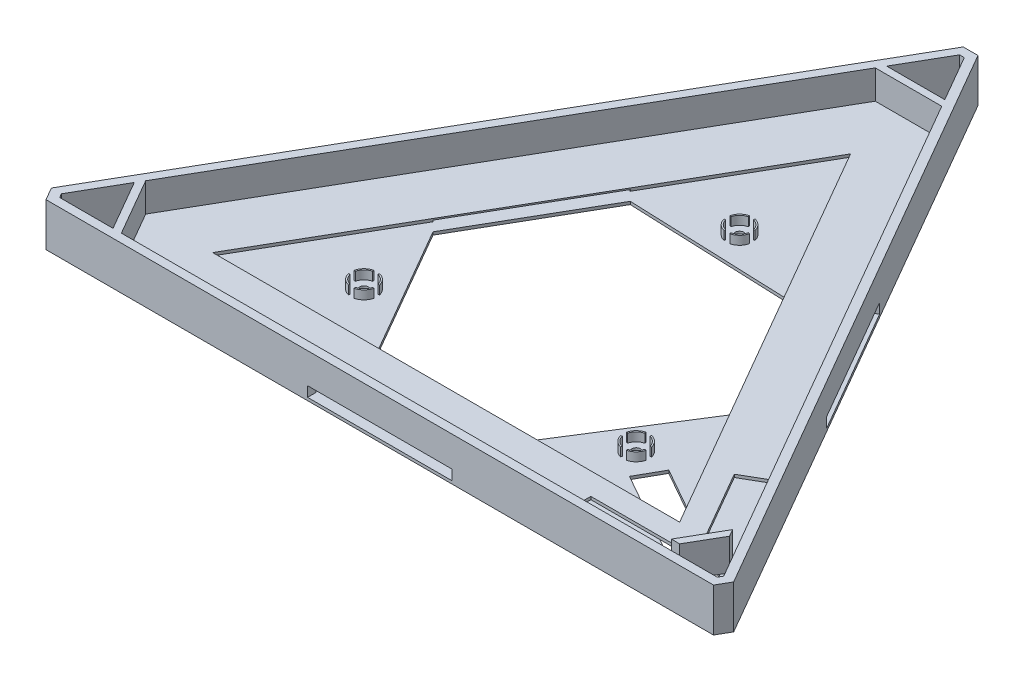
from build123d import *

# Parameters (mm, degrees)
SKETCH1_W                = 34.714871787
SKETCH1_H                = 10.923666426
BOSS_EXTRUDE1_DEPTH      = 1
BOSS_EXTRUDE2_DEPTH      = 11
BOSS_EXTRUDE3_DEPTH      = 5
BOSS_EXTRUDE3_DEPTH_BACK = 3
SKETCH3_W                = 50
SKETCH3_H                = 7
CUT_EXTRUDE3_DEPTH       = 25
SKETCH5_W                = 50
SKETCH5_H                = 7
CUT_EXTRUDE4_DEPTH       = 25
SKETCH6_W                = 50
SKETCH6_H                = 7
CUT_EXTRUDE5_DEPTH       = 25
SKETCH8_R                = 1.5
BOSS_EXTRUDE5_DEPTH      = 1
BOSS_EXTRUDE10_DEPTH     = 3


with BuildPart() as part:
    # Sketch1 → Boss-Extrude1 (new body)
    with BuildSketch(Plane(origin=(0, 0, 0), x_dir=(1, 0, 0), z_dir=(0, 1, 0))):
        Polygon((243.304219775, -116.484791865), (254.809280577, -136.408896137), (442.602090749, -136.409305398), (444.621046679, -132.925433224), (441.749040748, -132.925433224), (449.516726724, -119.471406458), (450.964695298, -121.978953123), (452.699916622, -118.984688018), (358.778179036, 43.666038065), (335.767496284, 43.666038065), align=None)
        with Locations((422.370878913, -129.522754792)):
            Rectangle(SKETCH1_W, SKETCH1_H, mode=Mode.SUBTRACT)
        Polygon((423.190377512, -92.577472767), (432.651287025, -87.114324326), (450.119365975, -117.364996826), (440.658456462, -122.828145267), align=None, mode=Mode.SUBTRACT)
        Polygon((428.113670919, -116.417164681), (266.439108268, -116.428009237), (347.273609729, 23.609230821), align=None, mode=Mode.SUBTRACT)
    extrude(amount=BOSS_EXTRUDE1_DEPTH)

    # Sketch1<9> → Boss-Extrude2 (add)
    # profile 1 of 2: a face of its own
    with BuildSketch(Plane(origin=(0, 0, 0), x_dir=(1, 0, 0), z_dir=(0, 1, 0))):
        Polygon((229.159432548, -134.984249184), (231.716666588, -139.412373829), (462.829865412, -139.412373829), (465.38624875, -134.984588004), (349.829542096, 65.165499075), (344.716133219, 65.165499075), align=None)
        Polygon((251.922647989, -136.409305399), (233.446303401, -136.408896138), (232.62355396, -134.984217357), (241.860901689, -118.984688018), align=None, mode=Mode.SUBTRACT)
        Polygon((442.602090749, -136.409305398), (254.809280577, -136.408896137), (243.304219775, -116.484791865), (335.767496284, 43.666038065), (358.778179036, 43.666038065), (461.938967958, -134.984588006), (461.116393749, -136.409305398), align=None, mode=Mode.SUBTRACT)
        Polygon((348.096628302, 62.164013367), (357.334800991, 46.166038067), (337.210874326, 46.166038067), (346.44844193, 62.165948237), align=None, mode=Mode.SUBTRACT)
    # profile 2 of 2: a face of its own
    with BuildSketch(Plane(origin=(0, 0, 0), x_dir=(1, 0, 0), z_dir=(0, 1, 0))):
        Polygon((441.749040748, -132.925433224), (444.621046679, -132.925433224), (450.964695298, -121.978953123), (449.516726724, -119.471406458), align=None)
    extrude(amount=BOSS_EXTRUDE2_DEPTH)

    # Sketch1<10> → Boss-Extrude3 (add, two sides: drawn at the far end of the back side and taken through both)
    with BuildSketch(Plane(origin=(0, 0, 0), x_dir=(1, 0, 0), z_dir=(0, 1, 0)).offset(-BOSS_EXTRUDE3_DEPTH_BACK)):
        Polygon((229.159432548, -134.984249184), (231.716666588, -139.412373829), (462.829865412, -139.412373829), (465.38624875, -134.984588004), (349.829542096, 65.165499075), (344.716133219, 65.165499075), align=None)
        Polygon((251.922647989, -136.409305399), (233.446303401, -136.408896138), (232.62355396, -134.984217357), (241.860901689, -118.984688018), align=None, mode=Mode.SUBTRACT)
        Polygon((442.602090749, -136.409305398), (254.809280577, -136.408896137), (243.304219775, -116.484791865), (335.767496284, 43.666038065), (358.778179036, 43.666038065), (452.699916622, -118.984688018), (461.938967958, -134.984588006), (461.116393749, -136.409305398), align=None, mode=Mode.SUBTRACT)
        Polygon((348.096628302, 62.164013367), (357.334800991, 46.166038067), (337.210874326, 46.166038067), (346.44844193, 62.165948237), align=None, mode=Mode.SUBTRACT)
    extrude(amount=BOSS_EXTRUDE3_DEPTH + BOSS_EXTRUDE3_DEPTH_BACK)

    # Sketch3 → Cut-Extrude3 (cut)
    with BuildSketch(Plane(origin=(290.589645397, 0, -167.772009994), x_dir=(-0.49999999999998745, 0, -0.8660254037844459), z_dir=(0.8660254037844459, 0, -0.49999999999998745))):
        with Locations((-236.592990632, -3)):
            Rectangle(SKETCH3_W, SKETCH3_H)
    extrude(amount=-CUT_EXTRUDE3_DEPTH, mode=Mode.SUBTRACT)

    # Sketch5 → Cut-Extrude4 (cut)
    with BuildSketch(Plane.XY.offset(139.412373829)):
        with Locations((347.273266, -3)):
            Rectangle(SKETCH5_W, SKETCH5_H)
    extrude(amount=-CUT_EXTRUDE4_DEPTH, mode=Mode.SUBTRACT)

    # Sketch6 → Cut-Extrude5 (cut)
    with BuildSketch(Plane(origin=(230.319375798, 0, 132.975171837), x_dir=(-0.5000006154012504, 0, 0.8660250484820695), z_dir=(-0.8660250484820695, 0, -0.5000006154012504))):
        with Locations((-113.236674799, -3)):
            Rectangle(SKETCH6_W, SKETCH6_H)
    extrude(amount=-CUT_EXTRUDE5_DEPTH, mode=Mode.SUBTRACT)

    # Sketch8 → Boss-Extrude5 (add)
    with BuildSketch(Plane.XZ.offset(3)):
        Polygon((349.829542096, -65.165499075), (465.38624875, 134.984588004), (462.829865412, 139.412373829), (231.716666588, 139.412373829), (229.159432548, 134.984249184), (344.716133219, -65.165499075), align=None)
        with Locations((395.323540807, 98.692824234)):
            Circle(SKETCH8_R, mode=Mode.SUBTRACT)
        with Locations((348.301285091, 15.863526629)):
            Circle(SKETCH8_R, mode=Mode.SUBTRACT)
        with Locations((299.654911442, 97.24168178)):
            Circle(SKETCH8_R, mode=Mode.SUBTRACT)
        Polygon((450.14703547, 123.280701064), (452.699916622, 118.984688018), (461.938967958, 134.984588006), (461.116393749, 136.409305398), (442.602090749, 136.409305398), (445.226665069, 131.986443715), (401.697951811, 107.384591709), (406.618322213, 98.678849058), align=None, mode=Mode.SUBTRACT)
        Polygon((322.273266, 116.42426408), (294.358218631, 68.061097964), (319.354499367, 24.757680453), (376.473657316, 26.969372806), (401.47267951, 70.271207531), (372.273266, 116.420910257), align=None, mode=Mode.SUBTRACT)
        Polygon((233.446303401, 136.408896138), (251.922647989, 136.409305399), (241.860901689, 118.984688018), (232.62355396, 134.984217357), align=None, mode=Mode.SUBTRACT)
        Polygon((337.210874326, -46.166038067), (357.334800991, -46.166038067), (348.096628302, -62.164013367), (346.44844193, -62.165948237), align=None, mode=Mode.SUBTRACT)
    extrude(amount=BOSS_EXTRUDE5_DEPTH)

    # Sketch12 → Boss-Extrude10 (add)
    with BuildSketch(Plane(origin=(0, -3, 0), x_dir=(1, 0, 0), z_dir=(0, 1, 0))):
        with BuildLine():
            ThreePointArc((352.690173981, -14.869718639), (351.483265607, -12.681546114), (349.295093082, -11.47463774))
            Line((349.295093081, -11.47463774), (349.184669971, -11.962292061))
            ThreePointArc((349.184669972, -11.962292061), (351.129712216, -13.035099504), (352.20251966, -14.980141749))
            Line((352.202519659, -14.980141749), (352.69017398, -14.869718639))
        make_face()
        with BuildLine():
            Line((347.417900211, -11.962292061), (347.307477101, -11.47463774))
            ThreePointArc((347.307477101, -11.47463774), (345.119304576, -12.681546114), (343.912396202, -14.869718639))
            Line((343.912396203, -14.869718639), (344.400050524, -14.980141749))
            ThreePointArc((344.400050523, -14.980141749), (345.472857967, -13.035099504), (347.417900211, -11.962292061))
        make_face()
        with BuildLine():
            ThreePointArc((349.295093082, -20.252415518), (351.483265607, -19.045507145), (352.690173981, -16.857334619))
            Line((352.69017398, -16.857334619), (352.202519659, -16.746911509))
            ThreePointArc((352.20251966, -16.746911509), (351.129712216, -18.691953754), (349.184669972, -19.764761197))
            Line((349.184669971, -19.764761197), (349.295093081, -20.252415518))
        make_face()
        with BuildLine():
            Line((344.400050524, -16.746911509), (343.912396203, -16.857334619))
            ThreePointArc((343.912396202, -16.857334619), (345.119304576, -19.045507145), (347.307477101, -20.252415518))
            Line((347.307477101, -20.252415518), (347.417900211, -19.764761197))
            ThreePointArc((347.417900211, -19.764761197), (345.472857967, -18.691953754), (344.400050523, -16.746911509))
        make_face()
        with BuildLine():
            Line((394.440155927, -94.791589666), (394.329732817, -94.303935345))
            ThreePointArc((394.329732817, -94.303935345), (392.141560292, -95.510843718), (390.934651918, -97.699016244))
            Line((390.934651918, -97.699016244), (391.4247896, -97.798542945))
            ThreePointArc((391.4247896, -97.798542945), (392.499067689, -95.860448622), (394.440155927, -94.791589666))
        make_face()
        with BuildLine():
            ThreePointArc((399.712429696, -97.699016244), (398.505521323, -95.510843718), (396.317348797, -94.303935345))
            Line((396.317348797, -94.303935345), (396.206925687, -94.791589666))
            ThreePointArc((396.206925687, -94.791589666), (398.151967932, -95.864397109), (399.224775375, -97.809439354))
            Line((399.224775375, -97.809439354), (399.712429696, -97.699016244))
        make_face()
        with BuildLine():
            Line((391.422306239, -99.576209114), (390.934651918, -99.686632224))
            ThreePointArc((390.934651918, -99.686632224), (392.141560292, -101.874804749), (394.329732817, -103.081713123))
            Line((394.329732817, -103.081713122), (394.440155927, -102.594058801))
            ThreePointArc((394.440155927, -102.594058802), (392.495113682, -101.521251358), (391.422306239, -99.576209114))
        make_face()
        with BuildLine():
            ThreePointArc((396.317348797, -103.081713123), (398.505521323, -101.874804749), (399.712429696, -99.686632224))
            Line((399.712429696, -99.686632224), (399.224775375, -99.576209114))
            ThreePointArc((399.224775375, -99.576209114), (398.151967932, -101.521251358), (396.206925687, -102.594058802))
            Line((396.206925687, -102.594058801), (396.317348797, -103.081713122))
        make_face()
        with BuildLine():
            ThreePointArc((298.661103452, -92.852792892), (296.472930927, -94.059701265), (295.266022553, -96.24787379))
            Line((295.266022553, -96.24787379), (295.753676874, -96.3582969))
            ThreePointArc((295.753676874, -96.3582969), (296.826484317, -94.413254656), (298.771526562, -93.340447213))
            Line((298.771526562, -93.340447212), (298.661103452, -92.852792891))
        make_face()
        with BuildLine():
            Line((295.753676874, -98.12506666), (295.266022553, -98.23548977))
            ThreePointArc((295.266022553, -98.23548977), (296.472930927, -100.423662295), (298.661103452, -101.630570669))
            Line((298.661103452, -101.630570669), (298.771526562, -101.142916348))
            ThreePointArc((298.771526562, -101.142916348), (296.826484317, -100.070108905), (295.753676874, -98.12506666))
        make_face()
        with BuildLine():
            ThreePointArc((304.04380033, -96.24787379), (302.836891957, -94.059701265), (300.648719432, -92.852792892))
            Line((300.648719432, -92.852792891), (300.538296322, -93.340447212))
            ThreePointArc((300.538296322, -93.340447213), (302.483338566, -94.413254656), (303.55614601, -96.3582969))
            Line((303.55614601, -96.3582969), (304.043800331, -96.24787379))
        make_face()
        with BuildLine():
            Line((300.538296322, -101.142916348), (300.648719432, -101.630570669))
            ThreePointArc((300.648719432, -101.630570669), (302.836891957, -100.423662295), (304.04380033, -98.23548977))
            Line((304.043800331, -98.23548977), (303.55614601, -98.12506666))
            ThreePointArc((303.55614601, -98.12506666), (302.483338566, -100.070108905), (300.538296322, -101.142916348))
        make_face()
    extrude(amount=BOSS_EXTRUDE10_DEPTH)


solid = part.part
